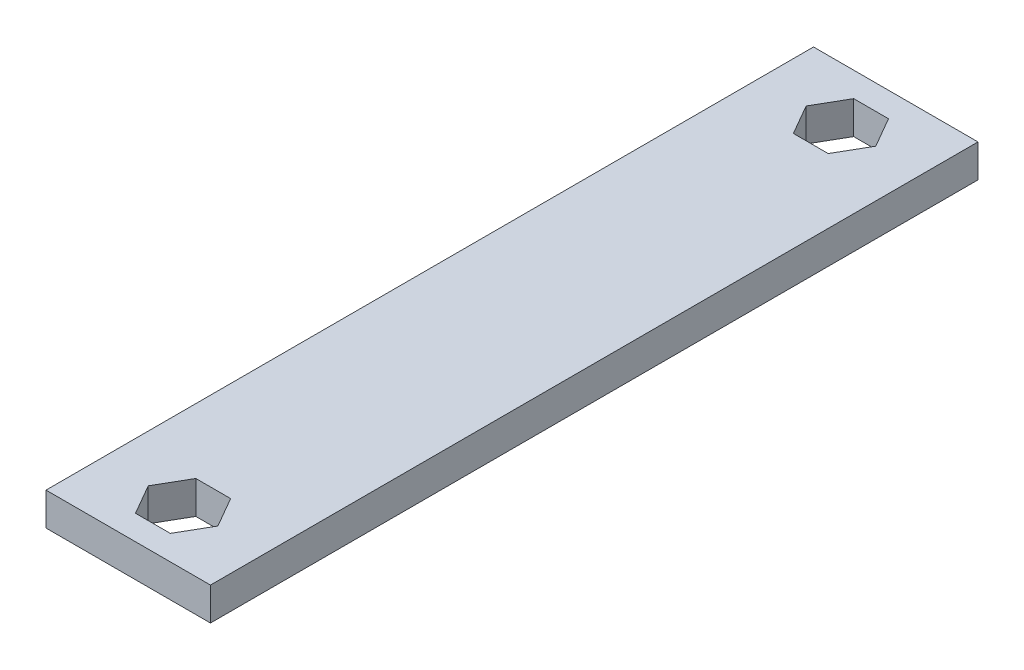
from build123d import *

# Parameters (mm, degrees)
SKETCH1_W           = 15
SKETCH1_H           = 70
BOSS_EXTRUDE1_DEPTH = 3


with BuildPart() as part:
    # Sketch1 → Boss-Extrude1 (new body)
    with BuildSketch(Plane(origin=(0, 0, 0), x_dir=(1, 0, 0), z_dir=(0, 1, 0))):
        with Locations((7.5, 35)):
            Rectangle(SKETCH1_W, SKETCH1_H)
        Polygon((9.08771324, 7.75), (5.91228676, 7.75), (4.324573519, 5), (5.91228676, 2.25), (9.08771324, 2.25), (10.675426481, 5), align=None, mode=Mode.SUBTRACT)
        Polygon((9.08771324, 62.25), (5.91228676, 62.25), (4.324573519, 65), (5.91228676, 67.75), (9.08771324, 67.75), (10.675426481, 65), align=None, mode=Mode.SUBTRACT)
    extrude(amount=BOSS_EXTRUDE1_DEPTH)


solid = part.part
